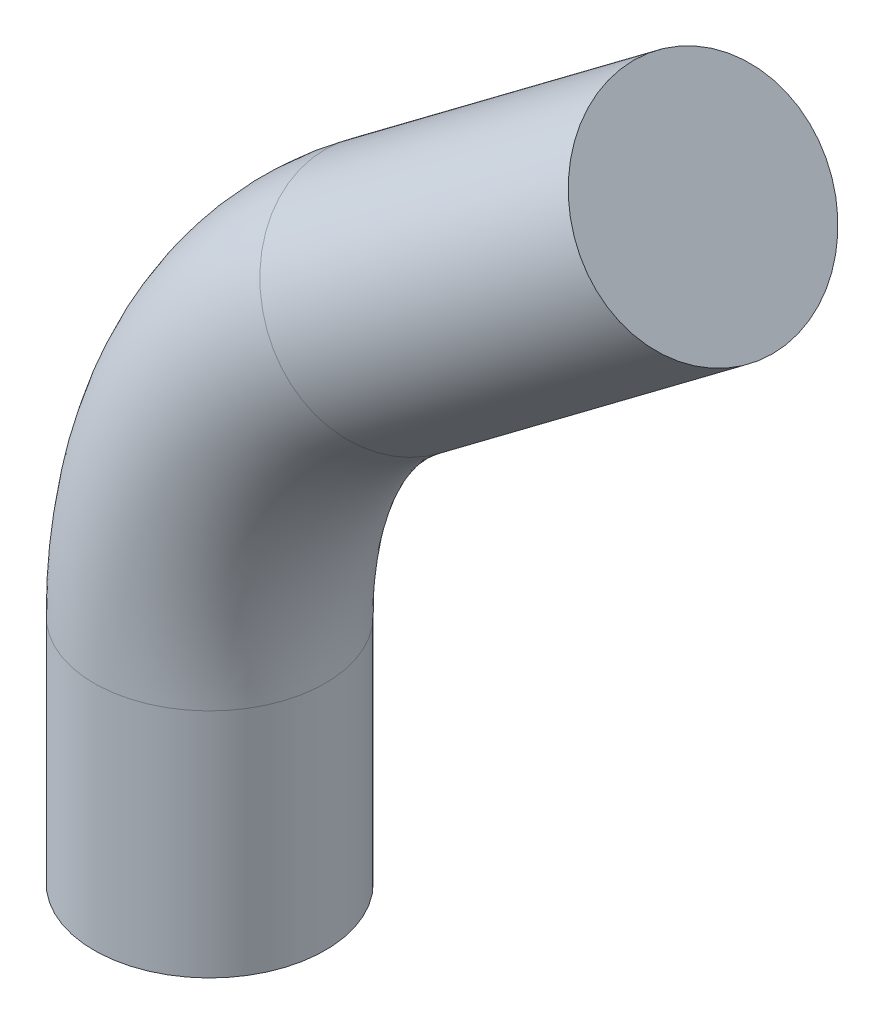
from build123d import *

# Parameters (mm, degrees)
SWEEP1_PROFILE_R = 2.5
SCALE1_SCALE     = 3


with BuildPart() as part:
    # Sweep1: sweep along a path in Sketch1
    with BuildLine(Plane.XY) as sweep1_path:
        Line((0, -10), (0, -5))
        ThreePointArc((0, -5), (1.05572809, -0.527864045), (4, 3))
        Line((4, 3), (10.666666667, 8))
    # Sweep1 profile (on start of the path) → Sweep1 (sweep)
    with BuildSketch(Plane(origin=(0, -10, 0), x_dir=(1, 0, 0), z_dir=(0, 1, 0))):
        Circle(SWEEP1_PROFILE_R)
    sweep(path=sweep1_path.line)


with BuildPart() as part_1:
    # Scale1: scaled about (0, 0, 0)
    add(part.part.scale(SCALE1_SCALE))


solid = part_1.part
